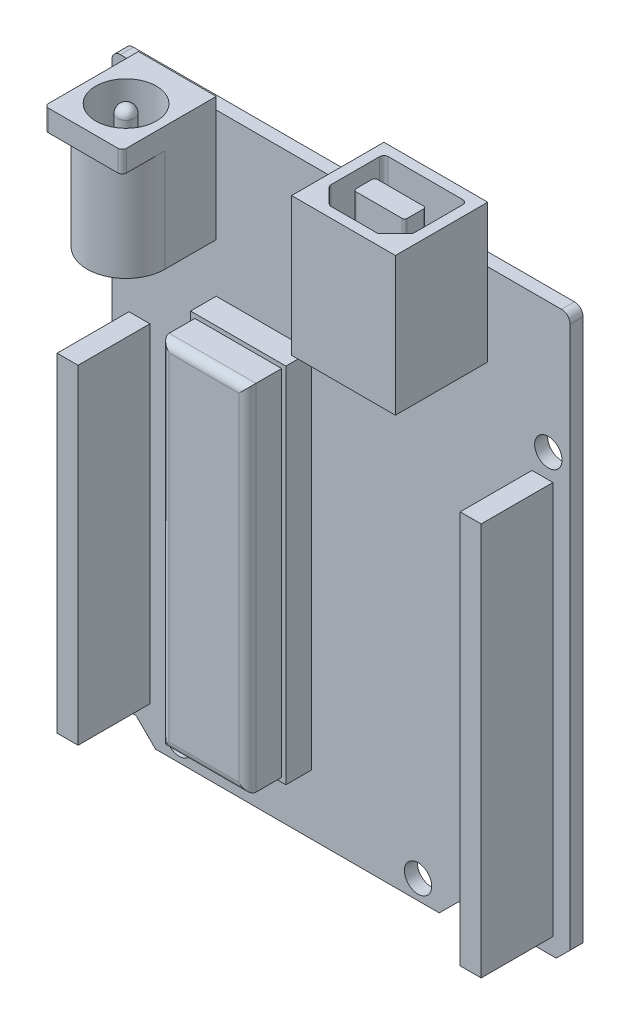
from build123d import *

# Parameters (mm, degrees)
ESBO_O2_R                = 1.6
RESSALTO_EXTRUS_O1_DEPTH = 1.52
ESBO_O3_W                = 9.096465254
ESBO_O3_H                = 14.507430643
RESSALTO_EXTRUS_O2_DEPTH = 11
ESBO_O4_W                = 2.45
ESBO_O4_H                = 38.5
ESBO_O4_H_2              = 46
RESSALTO_EXTRUS_O3_DEPTH = 8.4
CORTE_EXTRUS_O1_DEPTH    = 12
ESBO_O6_R                = 3.548232627
ESBO_O6_R_2              = 1
CORTE_EXTRUS_O2_DEPTH    = 12
FILETE1_R                = 1
FILETE2_R                = 0.5
ESBO_O7_W                = 12.140382315
ESBO_O7_H                = 16.18717642
RESSALTO_EXTRUS_O4_DEPTH = 10.8
CORTE_EXTRUS_O3_DEPTH    = 10
ESBO_O10_W               = 10.15094297
ESBO_O10_H               = 41.419472655
RESSALTO_EXTRUS_O5_DEPTH = 7
FILETE3_R                = 1
ESBO_O11_W               = 11.15094297
ESBO_O11_H               = 42.419472655
RESSALTO_EXTRUS_O6_DEPTH = 3


with BuildPart() as part:
    # Esboço2 → Ressalto-extrusão1 (new body)
    with BuildSketch(Plane.XY):
        with BuildLine():
            Line((26.8, -30.283131706), (25.193131706, -31.89))
            Line((25.193131706, -31.89), (13.76, -31.89))
            Line((13.76, -31.89), (11.5, -34.15))
            Line((11.5, -34.15), (-21.7, -34.15))
            Line((-21.7, -34.15), (-23.96, -31.89))
            Line((-23.96, -31.89), (-25.8, -31.89))
            ThreePointArc((-25.8, -31.89), (-26.507106781, -31.597106781), (-26.8, -30.89))
            Line((-26.8, -30.89), (-26.8, 33.15))
            ThreePointArc((-26.8, 33.15), (-26.507106781, 33.857106781), (-25.8, 34.15))
            Line((-25.8, 34.15), (25.8, 34.15))
            ThreePointArc((25.8, 34.15), (26.507106781, 33.857106781), (26.8, 33.15))
            Line((26.8, 33.15), (26.8, -30.283131706))
        make_face()
        with Locations((-24, 18.91)):
            Circle(ESBO_O2_R, mode=Mode.SUBTRACT)
        with Locations((24.26, 18.91)):
            Circle(ESBO_O2_R, mode=Mode.SUBTRACT)
        with Locations((-18.92, -31.89)):
            Circle(ESBO_O2_R, mode=Mode.SUBTRACT)
        with Locations((9.02, -31.89)):
            Circle(ESBO_O2_R, mode=Mode.SUBTRACT)
    extrude(amount=RESSALTO_EXTRUS_O1_DEPTH)

    # Esboço3 → Ressalto-extrusão2 (add)
    with BuildSketch(Plane.XY.offset(1.52)):
        with Locations((-19.138446447, 28.272429058)):
            Rectangle(ESBO_O3_W, ESBO_O3_H)
    extrude(amount=RESSALTO_EXTRUS_O2_DEPTH)

    # Esboço4 → Ressalto-extrusão3 (add)
    with BuildSketch(Plane.XY.offset(1.52)):
        with Locations((-23.575, -10.64)):
            Rectangle(ESBO_O4_W, ESBO_O4_H)
        with Locations((23.575, -6.89)):
            Rectangle(ESBO_O4_W, ESBO_O4_H_2)
    extrude(amount=RESSALTO_EXTRUS_O3_DEPTH)

    # Esboço5 → Corte-extrusão1 (cut)
    with BuildSketch(Plane.XZ.offset(-21.018713736)):
        with BuildLine():
            Line((-14.59021382, 7.52), (-14.59021382, 12.52))
            Line((-14.59021382, 12.52), (-23.686679074, 12.52))
            Line((-23.686679074, 12.52), (-23.686679074, 7.52))
            ThreePointArc((-23.686679074, 7.52), (-19.138446447, 12.068232627), (-14.59021382, 7.52))
        make_face()
    extrude(amount=-CORTE_EXTRUS_O1_DEPTH, mode=Mode.SUBTRACT)

    # Esboço6 → Corte-extrusão2 (cut)
    with BuildSketch(Plane.XZ.offset(-35.526144379)):
        with Locations(Location((-19.138446447, 7.52, 0), (0, 0, 270))):
            Circle(ESBO_O6_R)
        with Locations(Location((-19.138446447, 7.52, 0), (0, 0, 270))):
            Circle(ESBO_O6_R_2, mode=Mode.SUBTRACT)
    extrude(amount=CORTE_EXTRUS_O2_DEPTH, mode=Mode.SUBTRACT)

    # Filete1
    filete1_edges = [part.edges().sort_by_distance(p)[0] for p in [
        (-19.138446447, 35.526144379, 8.52),
    ]]
    fillet(filete1_edges, radius=FILETE1_R)

    # Filete2
    filete2_edges = [part.edges().sort_by_distance(p)[0] for p in [
        (-23.686679074, 34.272429057, 12.52),
        (-14.59021382, 34.272429057, 12.52),
    ]]
    fillet(filete2_edges, radius=FILETE2_R)

    # Esboço7 → Ressalto-extrusão4 (add)
    with BuildSketch(Plane.XY.offset(1.52)):
        with Locations((11.10014829, 32.59935696)):
            Rectangle(ESBO_O7_W, ESBO_O7_H)
    extrude(amount=RESSALTO_EXTRUS_O4_DEPTH)

    # Esboço9 → Corte-extrusão3 (cut)
    with BuildSketch(Plane(origin=(0, 40.69294517, 0), x_dir=(1, 0, 0), z_dir=(0, 1, 0))):
        with BuildLine():
            Line((6.729957133, -2.72), (15.470339448, -2.72))
            ThreePointArc((15.470339448, -2.72), (15.823892839, -2.866446609), (15.970339448, -3.22))
            Line((15.970339448, -3.22), (15.970339448, -8.912893219))
            ThreePointArc((15.970339448, -8.912893219), (15.932279214, -9.104234935), (15.823892839, -9.266446609))
            Line((15.823892839, -9.266446609), (14.116786058, -10.973553391))
            ThreePointArc((14.116786058, -10.973553391), (13.954574383, -11.081939766), (13.763232667, -11.12))
            Line((13.763232667, -11.12), (8.437063914, -11.12))
            ThreePointArc((8.437063914, -11.12), (8.245722198, -11.081939766), (8.083510523, -10.973553391))
            Line((8.083510523, -10.973553391), (6.376403742, -9.266446609))
            ThreePointArc((6.376403742, -9.266446609), (6.268017366, -9.104234935), (6.229957133, -8.912893219))
            Line((6.229957133, -8.912893219), (6.229957133, -3.22))
            ThreePointArc((6.229957133, -3.22), (6.376403742, -2.866446609), (6.729957133, -2.72))
        make_face()
        with BuildLine():
            Line((13.80014829, -8.17), (8.40014829, -8.17))
            ThreePointArc((8.40014829, -8.17), (8.188016256, -8.082132034), (8.10014829, -7.87))
            Line((8.10014829, -7.87), (8.10014829, -5.97))
            ThreePointArc((8.10014829, -5.97), (8.188016256, -5.757867966), (8.40014829, -5.67))
            Line((8.40014829, -5.67), (13.80014829, -5.67))
            ThreePointArc((13.80014829, -5.67), (14.012280325, -5.757867966), (14.10014829, -5.97))
            Line((14.10014829, -5.97), (14.10014829, -7.87))
            ThreePointArc((14.10014829, -7.87), (14.012280325, -8.082132034), (13.80014829, -8.17))
        make_face(mode=Mode.SUBTRACT)
    extrude(amount=-CORTE_EXTRUS_O3_DEPTH, mode=Mode.SUBTRACT)

    # Esboço10 → Ressalto-extrusão5 (add)
    with BuildSketch(Plane.XY.offset(1.52)):
        with Locations((-9.018025228, -5.927819482)):
            Rectangle(ESBO_O10_W, ESBO_O10_H)
    extrude(amount=RESSALTO_EXTRUS_O5_DEPTH)

    # Filete3
    filete3_edges = [part.edges().sort_by_distance(p)[0] for p in [
        (-3.942553743, -5.927819482, 8.52),
        (-9.018025228, 14.781916846, 8.52),
        (-14.093496713, -5.927819482, 8.52),
        (-9.018025228, -26.637555809, 8.52),
    ]]
    fillet(filete3_edges, radius=FILETE3_R)

    # Esboço11 → Ressalto-extrusão6 (add)
    with BuildSketch(Plane.XY.offset(1.52)):
        with Locations((-9.018025228, -5.927819482)):
            Rectangle(ESBO_O11_W, ESBO_O11_H)
    extrude(amount=RESSALTO_EXTRUS_O6_DEPTH)


solid = part.part
